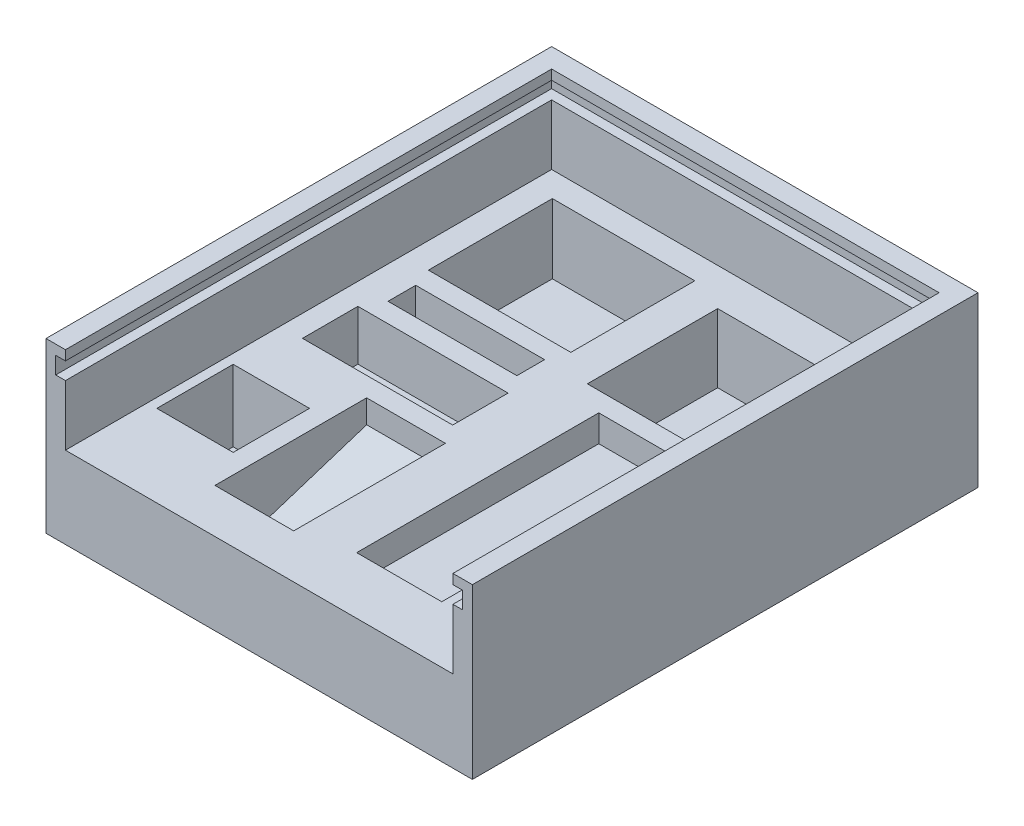
from build123d import *

# Parameters (mm, degrees)
SKETCH1_W            = 26.5
SKETCH1_H            = 5.7
BOSS_EXTRUDE1_DEPTH  = 0.7
SKETCH1_3_W          = 30.9
SKETCH1_3_H          = 11.4
BOSS_EXTRUDE2_DEPTH  = 4.5
SKETCH1_4_W          = 29.3
SKETCH1_4_H          = 25.5
BOSS_EXTRUDE3_DEPTH  = 0.5
SKETCH1_5_W          = 15.7
SKETCH1_5_H          = 15.7
BOSS_EXTRUDE4_DEPTH  = 0.1
SKETCH1_7_W          = 17.5
SKETCH1_7_H          = 49.8
BOSS_EXTRUDE6_DEPTH  = 9.3
SKETCH1_8_W          = 26.6
SKETCH1_8_H          = 26.8
BOSS_EXTRUDE7_DEPTH  = 0.7
SKETCH1_10_W         = 83.7
SKETCH1_10_H         = 100
SKETCH1_10_W_2       = 29.3
SKETCH1_10_H_2       = 25.5
SKETCH1_10_W_3       = 26.5
SKETCH1_10_H_3       = 5.7
SKETCH1_10_W_4       = 30.9
SKETCH1_10_H_4       = 11.4
SKETCH1_10_W_5       = 16.2
SKETCH1_10_H_5       = 31.2
SKETCH1_10_W_6       = 15.7
SKETCH1_10_H_6       = 15.7
SKETCH1_10_W_7       = 26.6
SKETCH1_10_H_7       = 26.8
SKETCH1_10_W_8       = 17.5
SKETCH1_10_H_8       = 49.8
BOSS_EXTRUDE8_DEPTH  = 14.8
BOSS_EXTRUDE9_DEPTH  = 2
SKETCH1_12_W         = 83.7
SKETCH1_12_H         = 2
BOSS_EXTRUDE10_DEPTH = 2
BOSS_EXTRUDE11_DEPTH = 27.2
SKETCH1_14_W         = 83.7
SKETCH1_14_H         = 2
BOSS_EXTRUDE12_DEPTH = 14.8
BOSS_EXTRUDE13_DEPTH = 12.4
BOSS_EXTRUDE14_DEPTH = 32.7
BOSS_EXTRUDE15_DEPTH = 2
BOSS_EXTRUDE16_DEPTH = 16.2


with BuildPart() as part:
    # Sketch1 → Boss-Extrude1 (new body)
    with BuildSketch(Plane(origin=(0, 0, 0), x_dir=(1, 0, 0), z_dir=(0, 1, 0))):
        with Locations((-19.95, 11.55)):
            Rectangle(SKETCH1_W, SKETCH1_H)
    extrude(amount=BOSS_EXTRUDE1_DEPTH)



with BuildPart() as body_2:
    # Sketch1<3> → Boss-Extrude2 (new body)
    with BuildSketch(Plane(origin=(0, 0, 0), x_dir=(1, 0, 0), z_dir=(0, 1, 0))):
        with Locations((-19.95, -1)):
            Rectangle(SKETCH1_3_W, SKETCH1_3_H)
    extrude(amount=BOSS_EXTRUDE2_DEPTH)


with BuildPart() as body_3:
    # Sketch1<4> → Boss-Extrude3 (new body)
    with BuildSketch(Plane(origin=(0, 0, 0), x_dir=(1, 0, 0), z_dir=(0, 1, 0))):
        with Locations((-19.95, 31.15)):
            Rectangle(SKETCH1_4_W, SKETCH1_4_H)
    extrude(amount=BOSS_EXTRUDE3_DEPTH)


with BuildPart() as body_4:
    # Sketch1<5> → Boss-Extrude4 (new body)
    with BuildSketch(Plane(origin=(0, 0, 0), x_dir=(1, 0, 0), z_dir=(0, 1, 0))):
        with Locations((-30.05, -26.3)):
            Rectangle(SKETCH1_5_W, SKETCH1_5_H)
    extrude(amount=BOSS_EXTRUDE4_DEPTH)


with BuildPart() as body_5:
    # Sketch1<7> → Boss-Extrude6 (new body)
    with BuildSketch(Plane(origin=(0, 0, 0), x_dir=(1, 0, 0), z_dir=(0, 1, 0))):
        with Locations((17.1, -14.4)):
            Rectangle(SKETCH1_7_W, SKETCH1_7_H)
    extrude(amount=BOSS_EXTRUDE6_DEPTH)


with BuildPart() as body_6:
    # Sketch1<8> → Boss-Extrude7 (new body)
    with BuildSketch(Plane(origin=(0, 0, 0), x_dir=(1, 0, 0), z_dir=(0, 1, 0))):
        with Locations((15.3, 27.9)):
            Rectangle(SKETCH1_8_W, SKETCH1_8_H)
    extrude(amount=BOSS_EXTRUDE7_DEPTH)


with BuildPart() as part_1:
    add(part.part)

    add(body_2.part)  # Boss-Extrude8 merges body 2

    add(body_3.part)  # Boss-Extrude8 merges body 3

    add(body_4.part)  # Boss-Extrude8 merges body 4

    add(body_5.part)  # Boss-Extrude8 merges body 5

    add(body_6.part)  # Boss-Extrude8 merges body 6
    # Sketch1<10> → Boss-Extrude8 (add)
    with BuildSketch(Plane(origin=(0, 0, 0), x_dir=(1, 0, 0), z_dir=(0, 1, 0))):
        with Locations((0, 1)):
            Rectangle(SKETCH1_10_W, SKETCH1_10_H)
        with Locations((-19.95, 31.15)):
            Rectangle(SKETCH1_10_W_2, SKETCH1_10_H_2, mode=Mode.SUBTRACT)
        with Locations((-19.95, 11.55)):
            Rectangle(SKETCH1_10_W_3, SKETCH1_10_H_3, mode=Mode.SUBTRACT)
        with Locations((-19.95, -1)):
            Rectangle(SKETCH1_10_W_4, SKETCH1_10_H_4, mode=Mode.SUBTRACT)
        with Locations((-10.1, -26.3)):
            Rectangle(SKETCH1_10_W_5, SKETCH1_10_H_5, mode=Mode.SUBTRACT)
        with Locations((-30.05, -26.3)):
            Rectangle(SKETCH1_10_W_6, SKETCH1_10_H_6, mode=Mode.SUBTRACT)
        with Locations((15.3, 27.9)):
            Rectangle(SKETCH1_10_W_7, SKETCH1_10_H_7, mode=Mode.SUBTRACT)
        with Locations((17.1, -14.4)):
            Rectangle(SKETCH1_10_W_8, SKETCH1_10_H_8, mode=Mode.SUBTRACT)
    extrude(amount=BOSS_EXTRUDE8_DEPTH)

    # Sketch1<11> → Boss-Extrude9 (add)
    with BuildSketch(Plane(origin=(0, 0, 0), x_dir=(1, 0, 0), z_dir=(0, 1, 0))):
        Polygon((-43.85, -51), (-41.85, -51), (-41.85, -49), (41.85, -49), (41.85, -51), (43.85, -51), (43.85, 53), (-43.85, 53), align=None)
    extrude(amount=-BOSS_EXTRUDE9_DEPTH)

    # Sketch1<12> → Boss-Extrude10 (add)
    with BuildSketch(Plane(origin=(0, 0, 0), x_dir=(1, 0, 0), z_dir=(0, 1, 0))):
        with Locations((0, -50)):
            Rectangle(SKETCH1_12_W, SKETCH1_12_H)
    extrude(amount=-BOSS_EXTRUDE10_DEPTH)

    # Sketch1<13> → Boss-Extrude11 (add)
    with BuildSketch(Plane(origin=(0, 0, 0), x_dir=(1, 0, 0), z_dir=(0, 1, 0))):
        Polygon((-43.85, -51), (-41.85, -51), (-41.85, -49), (-41.85, 51), (-2, 51), (2, 51), (41.85, 51), (41.85, -49), (41.85, -51), (43.85, -51), (43.85, 53), (-43.85, 53), align=None)
    extrude(amount=BOSS_EXTRUDE11_DEPTH)

    # Sketch1<14> → Boss-Extrude12 (add)
    with BuildSketch(Plane(origin=(0, 0, 0), x_dir=(1, 0, 0), z_dir=(0, 1, 0))):
        with Locations((0, -50)):
            Rectangle(SKETCH1_14_W, SKETCH1_14_H)
    extrude(amount=BOSS_EXTRUDE12_DEPTH)

    # Sketch2 → Boss-Extrude13 (add)
    with BuildSketch(Plane(origin=(0, 14.8, 0), x_dir=(1, 0, 0), z_dir=(0, 1, 0))):
        Polygon((-39.85, -51), (-39.85, 49), (39.85, 49), (39.85, -51), (41.85, -51), (41.85, 51), (-41.85, 51), (-41.85, -51), align=None)
    extrude(amount=BOSS_EXTRUDE13_DEPTH)

    # Sketch1<15> → Boss-Extrude14 (add)
    with BuildSketch(Plane(origin=(0, 0, 0), x_dir=(1, 0, 0), z_dir=(0, 1, 0))):
        Polygon((-43.85, -51), (-41.85, -51), (-41.85, -49), (-41.85, 51), (-2, 51), (2, 51), (41.85, 51), (41.85, -49), (41.85, -51), (43.85, -51), (43.85, 53), (-43.85, 53), align=None)
    extrude(amount=BOSS_EXTRUDE14_DEPTH)

    # Sketch3 → Boss-Extrude15 (add)
    with BuildSketch(Plane(origin=(0, 32.7, 0), x_dir=(1, 0, 0), z_dir=(0, 1, 0))):
        Polygon((-41.85, -51), (-39.85, -51), (-39.85, 49), (39.85, 49), (39.85, -51), (41.85, -51), (41.85, 51), (-41.85, 51), align=None)
    extrude(amount=-BOSS_EXTRUDE15_DEPTH)

    # Sketch4 → Boss-Extrude16 (add)
    with BuildSketch(Plane(origin=(-18.2, 0, 0), x_dir=(0, 0, -1), z_dir=(1, 0, 0))):
        Polygon((-10.7, 10), (-10.7, 0), (-41.9, 0), align=None)
    extrude(amount=BOSS_EXTRUDE16_DEPTH)


solid = part_1.part
